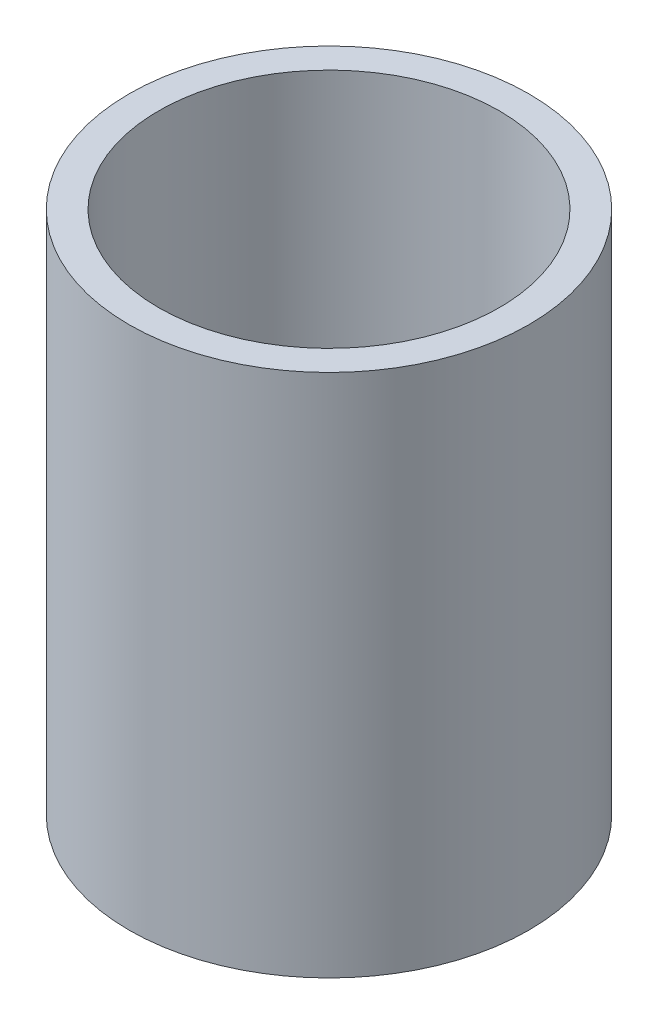
from build123d import *

# Parameters (mm, degrees)
SKETCH1_R           = 15.25
SKETCH1_R_2         = 13
BOSS_EXTRUDE1_DEPTH = 40


with BuildPart() as part:
    # Sketch1 → Boss-Extrude1 (new body)
    with BuildSketch(Plane(origin=(0, 0, 0), x_dir=(1, 0, 0), z_dir=(0, 1, 0))):
        with Locations(Location((0, 0, 0), (0, 0, 270))):
            Circle(SKETCH1_R)
        with Locations(Location((0, 0, 0), (0, 0, 270))):
            Circle(SKETCH1_R_2, mode=Mode.SUBTRACT)
    extrude(amount=BOSS_EXTRUDE1_DEPTH)


solid = part.part
